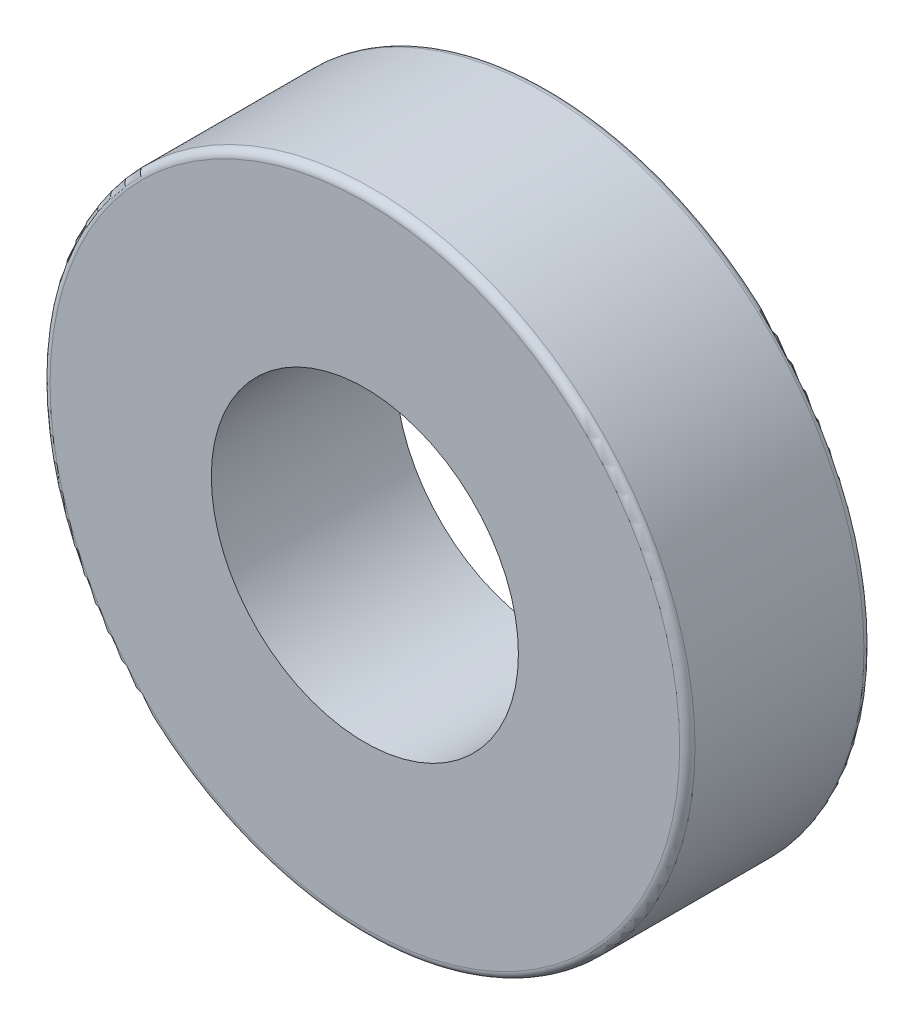
from build123d import *

# Parameters (mm, degrees)
SKETCH2_R           = 21
SKETCH2_R_2         = 10
BOSS_EXTRUDE1_DEPTH = 12
FILLET1_R           = 0.5


with BuildPart() as part:
    # Sketch2 → Boss-Extrude1 (new body)
    with BuildSketch(Plane.XY):
        Circle(SKETCH2_R)
        Circle(SKETCH2_R_2, mode=Mode.SUBTRACT)
    extrude(amount=BOSS_EXTRUDE1_DEPTH)

    # Fillet1
    fillet1_edges = [part.edges().sort_by_distance(p)[0] for p in [
        (-21, 0, 0),
        (-21, 0, 12),
    ]]
    fillet(fillet1_edges, radius=FILLET1_R)


solid = part.part
